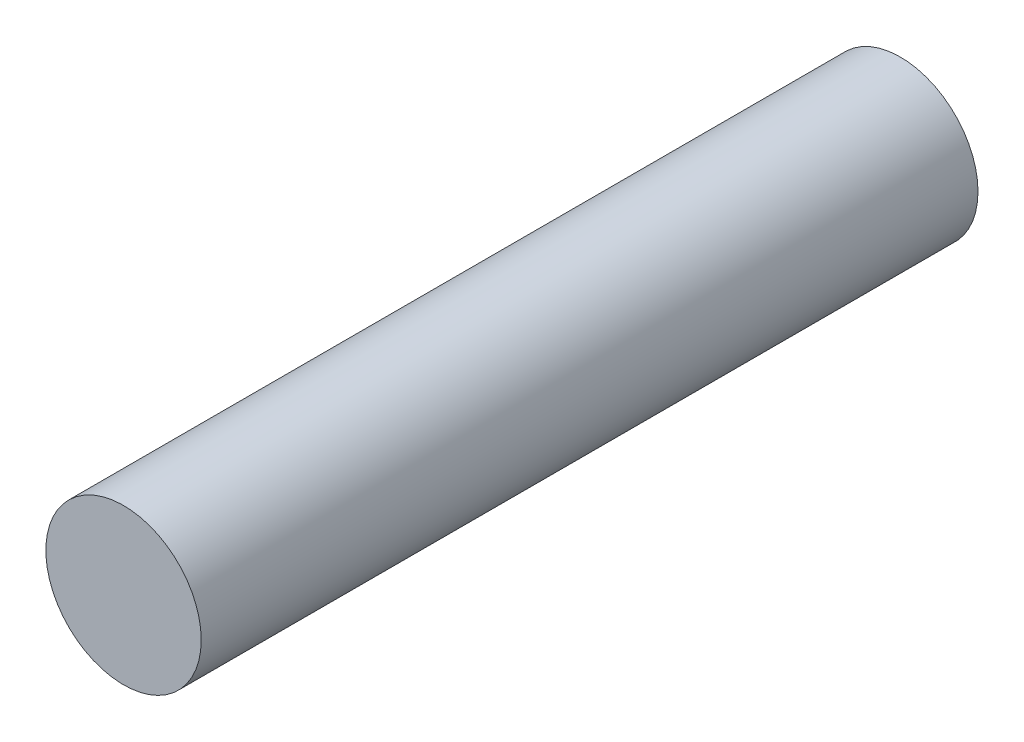
from build123d import *

# Parameters (mm, degrees)
SKETCH2_W = 0.5
SKETCH2_H = 5


with BuildPart() as part:
    # Sketch2 → Revolve-Thin1 (revolve)
    with BuildSketch(Plane(origin=(0, 0, 0), x_dir=(1, 0, 0), z_dir=(0, 1, 0)), mode=Mode.PRIVATE) as revolve_thin1_sk:
        with Locations((-0.25, 2.5)):
            Rectangle(SKETCH2_W, SKETCH2_H)
    revolve(revolve_thin1_sk.sketch.rotate(Axis((0, 0, 0), (0, 0, -1)), 180), axis=Axis((0, 0, 0), (0, 0, -1)))


solid = part.part
